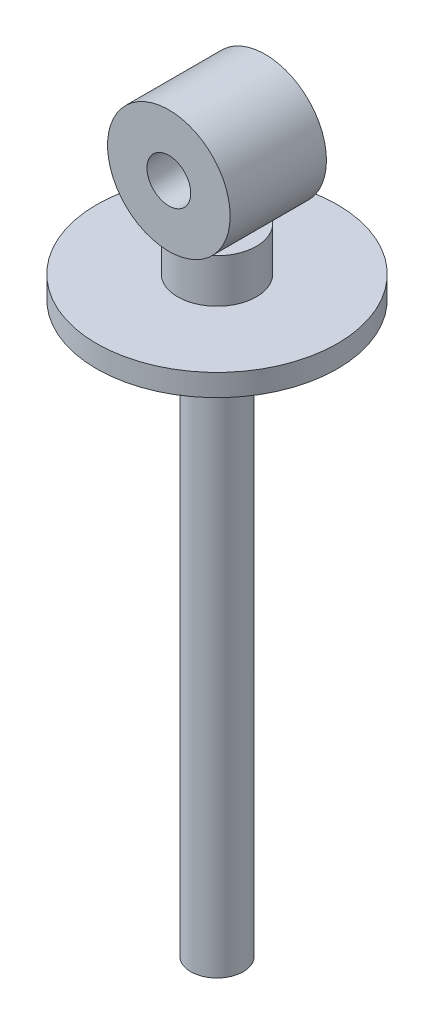
from build123d import *

# Parameters (mm, degrees)
SKETCH_1_R      = 27.5
EXTRUDE_1_DEPTH = 5
SKETCH_2_R      = 9
EXTRUDE_2_DEPTH = 10
SKETCH_3_R      = 14
SKETCH_3_R_2    = 5
EXTRUDE_3_DEPTH = 11
SKETCH_4_R      = 6
EXTRUDE_4_DEPTH = 130


with BuildPart() as part:
    # Эскиз1 → Бобышка-Вытянуть1 (new body)
    with BuildSketch(Plane(origin=(0, 0, 0), x_dir=(1, 0, 0), z_dir=(0, 1, 0))):
        with Locations(Location((0, 0, 0), (0, 0, 270))):
            Circle(SKETCH_1_R)
    extrude(amount=EXTRUDE_1_DEPTH)

    # Эскиз2 → Бобышка-Вытянуть2 (add)
    with BuildSketch(Plane(origin=(0, 5, 0), x_dir=(1, 0, 0), z_dir=(0, 1, 0))):
        with Locations(Location((0, 0, 0), (0, 0, 270))):
            Circle(SKETCH_2_R)
    extrude(amount=EXTRUDE_2_DEPTH)

    # Эскиз4 → Бобышка-Вытянуть4 (add)
    with BuildSketch(Plane.XZ):
        with Locations(Location((0, 0, 0), (0, 0, 90))):
            Circle(SKETCH_4_R)
    extrude(amount=EXTRUDE_4_DEPTH)


with BuildPart() as body_2:
    # Эскиз3 → Бобышка-Вытянуть3 (new, symmetric)
    with BuildSketch(Plane.XY):
        with Locations((0, 29)):
            Circle(SKETCH_3_R)
        with Locations((0, 29)):
            Circle(SKETCH_3_R_2, mode=Mode.SUBTRACT)
    extrude(amount=EXTRUDE_3_DEPTH, both=True)


solid = Compound([part.part, body_2.part])
